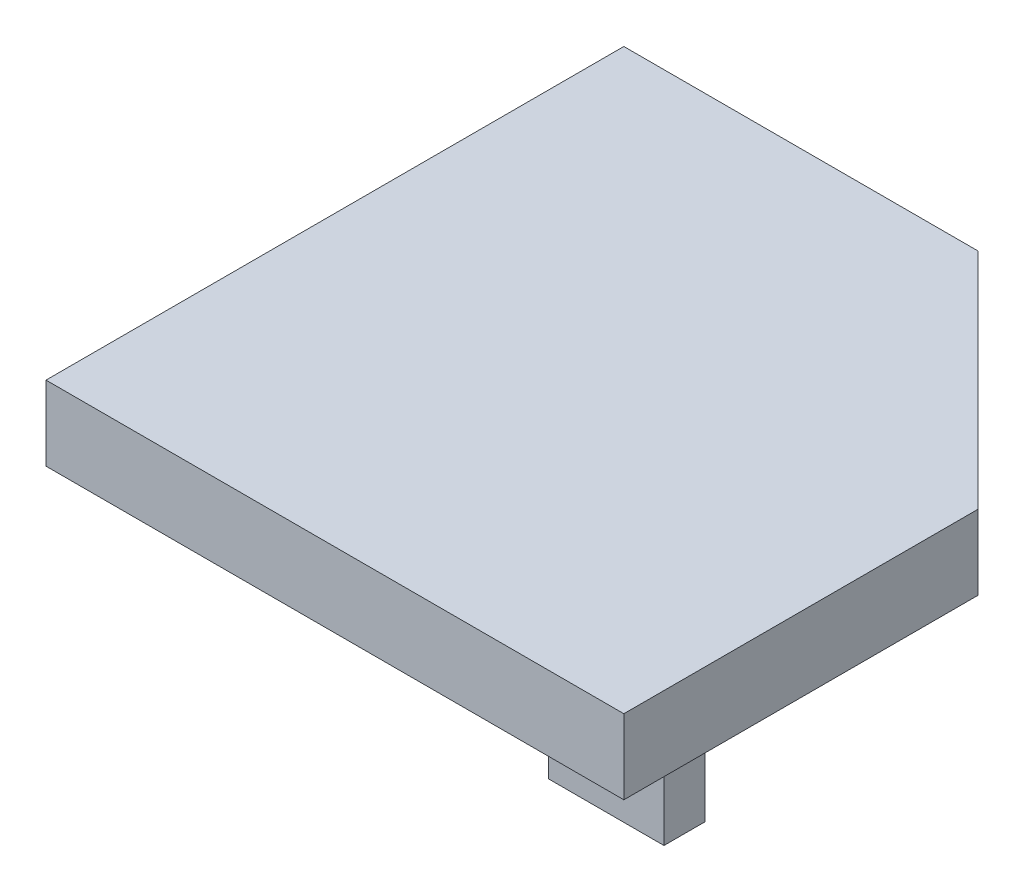
from build123d import *

# Parameters (mm, degrees)
SKETCH1_W           = 19.685
SKETCH1_H           = 19.685
BOSS_EXTRUDE1_DEPTH = 2.54
SKETCH3_W           = 1.397
SKETCH3_H           = 3.937
SKETCH3_W_2         = 3.937
SKETCH3_H_2         = 1.397
BOSS_EXTRUDE2_DEPTH = 4.572
CHAMFER1_SIZE       = 7.62


with BuildPart() as part:
    # Sketch1 → Boss-Extrude1 (new body)
    with BuildSketch(Plane(origin=(0, 0, 0), x_dir=(1, 0, 0), z_dir=(0, 1, 0))):
        Rectangle(SKETCH1_W, SKETCH1_H)
    extrude(amount=BOSS_EXTRUDE1_DEPTH)

    # Sketch3 → Boss-Extrude2 (add)
    with BuildSketch(Plane.XZ):
        with Locations((-4.98475, -5.08)):
            Rectangle(SKETCH3_W, SKETCH3_H)
        with Locations((5.334, 5.23748)):
            Rectangle(SKETCH3_W_2, SKETCH3_H_2)
    extrude(amount=BOSS_EXTRUDE2_DEPTH)

    # Chamfer1
    chamfer1_edges = [part.edges().sort_by_distance(p)[0] for p in [
        (9.8425, 1.27, -9.8425),
    ]]
    chamfer(chamfer1_edges, length=CHAMFER1_SIZE)


solid = part.part
